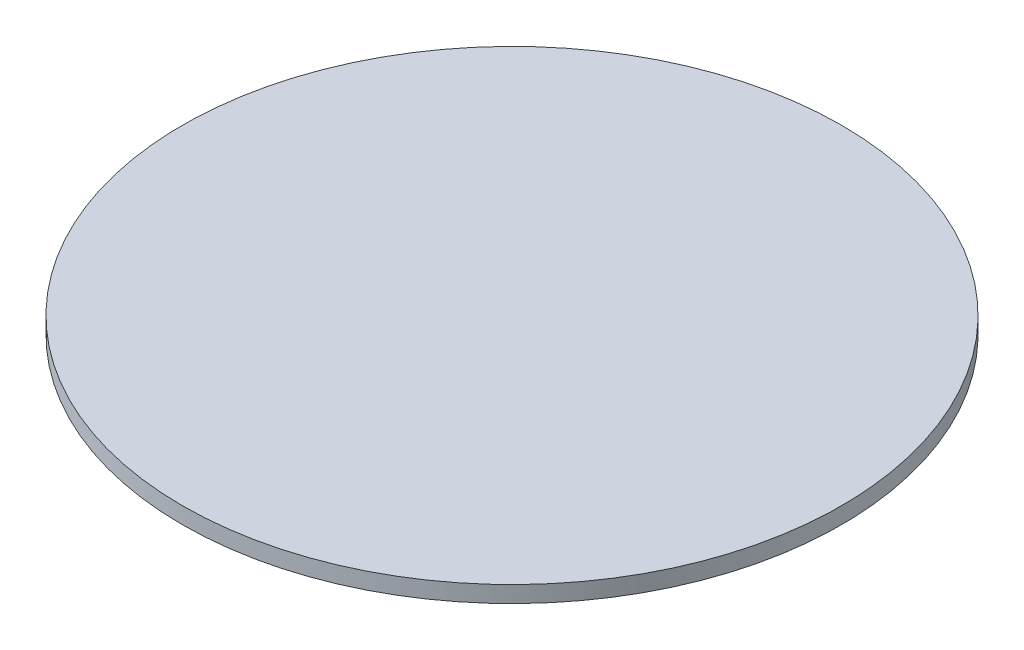
from build123d import *

# Parameters (mm, degrees)
SKETCH1_R           = 127
BOSS_EXTRUDE1_DEPTH = 6.35


with BuildPart() as part:
    # Sketch1 → Boss-Extrude1 (new body)
    with BuildSketch(Plane(origin=(0, 0, 0), x_dir=(1, 0, 0), z_dir=(0, 1, 0))):
        with Locations(Location((0, 0, 0), (0, 0, 270))):
            Circle(SKETCH1_R)
    extrude(amount=BOSS_EXTRUDE1_DEPTH)


solid = part.part
